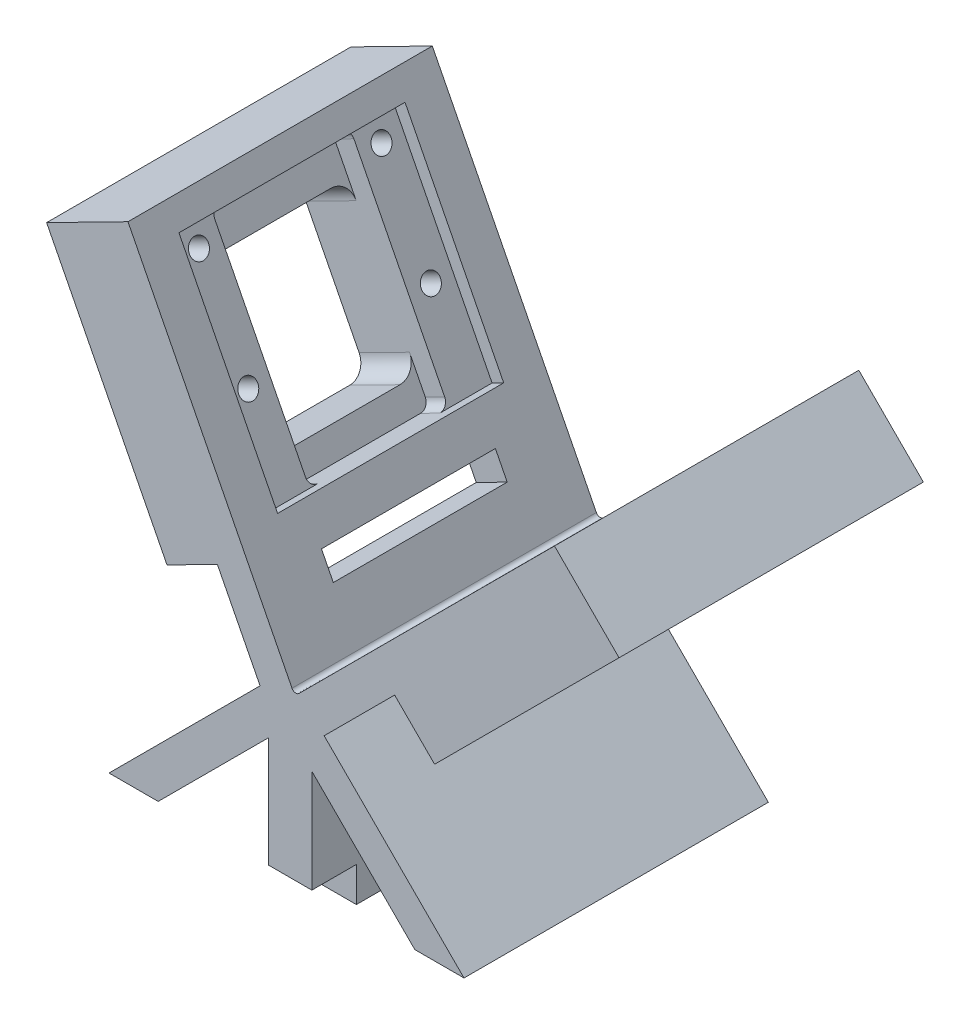
from build123d import *

# Parameters (mm, degrees)
BOSS_EXTRUDE1_DEPTH      = 35
BOSS_EXTRUDE2_DEPTH      = 35
FILLET1_R                = 0.5
SKETCH3_W                = 26
SKETCH3_H                = 25
CUT_EXTRUDE1_DEPTH       = 1.5
SKETCH4_W                = 16
SKETCH4_H                = 25
CUT_EXTRUDE2_DEPTH       = 5
FILLET3_R                = 1
SKETCH5_W                = 26
SKETCH5_H                = 25
CUT_EXTRUDE3_DEPTH       = 1.5
SKETCH6_W                = 16
SKETCH6_H                = 25
CUT_EXTRUDE4_DEPTH       = 5
FILLET4_R                = 1
SKETCH8_W                = 20
SKETCH8_H                = 3
CUT_EXTRUDE5_DEPTH       = 4
SKETCH9_W                = 20
SKETCH9_H                = 3
CUT_EXTRUDE6_DEPTH       = 4
SKETCH10_W               = 20
SKETCH10_H               = 3
CUT_EXTRUDE7_DEPTH       = 4
SKETCH11_R               = 1.1
CUT_EXTRUDE8_DEPTH       = 10
SKETCH12_R               = 1.1
CUT_EXTRUDE9_DEPTH       = 5
BOSS_EXTRUDE3_DEPTH      = 3.5
BOSS_EXTRUDE3_DEPTH_BACK = 1
SKETCH14_W               = 35
SKETCH14_H               = 3.801557548
SKETCH15_W               = 1.5
SKETCH15_H               = 31
CUT_EXTRUDE10_DEPTH      = 5
SKETCH18_W               = 35
SKETCH18_H               = 30
SKETCH18_R               = 1.1
SKETCH18_W_2             = 16
SKETCH18_H_2             = 20
BOSS_EXTRUDE4_DEPTH      = 6.5
SKETCH19_W               = 35
SKETCH19_H               = 30.5
SKETCH19_R               = 1.1
SKETCH19_W_2             = 16
SKETCH19_H_2             = 17.5
BOSS_EXTRUDE5_DEPTH      = 6.5
CUT_EXTRUDE12_DEPTH      = 2.5
CUT_EXTRUDE12_DEPTH_BACK = 10
SKETCH20_W               = 93.401628658
SKETCH20_H               = 53.255346894
SKETCH21_W               = 5
SKETCH21_H               = 4
CUT_EXTRUDE13_DEPTH      = 5.125
FILLET9_R                = 2
FILLET10_R               = 2
BOSS_EXTRUDE8_DEPTH      = 35


with BuildPart() as part:
    # Sketch1 → Boss-Extrude1 (new body)
    with BuildSketch(Plane.XY):
        Polygon((6.55, 4.55), (-6.55, 4.55), (-6.55, -4.55), (-2.05, -4.55), (-2.05, -2.05), (-4.05, -2.05), (-4.05, 2.05), (4.05, 2.05), (4.05, -2.05), (2.05, -2.05), (2.05, -4.55), (6.55, -4.55), align=None)
    extrude(amount=BOSS_EXTRUDE1_DEPTH)

    # Sketch2 → Boss-Extrude2 (add, through all)
    with BuildSketch(Plane.XY.offset(35)):
        Polygon((2.5, 4.55), (2.5, 25.721572875), (33.234018716, 56.455591591), (30.405591591, 59.284018716), (0.532284417, 29.410711541), (-18.64755944, 67.053274588), (-22.211585537, 65.237312589), (-2.5, 26.551147735), (-2.5, 4.55), align=None)
    extrude(amount=-BOSS_EXTRUDE2_DEPTH)

    # Fillet1
    fillet1_edges = [part.edges().sort_by_distance(p)[0] for p in [
        (0.532284417, 29.410711541, 17.5),
    ]]
    fillet(fillet1_edges, radius=FILLET1_R)

    # Sketch3 → Cut-Extrude1 (cut)
    with BuildSketch(Plane(origin=(-14.439213562, 14.439213562, 0), x_dir=(0, 0, 1), z_dir=(-0.7071067811865464, 0.7071067811865488, 0))):
        with Locations((17.5, 47.92013165)):
            Rectangle(SKETCH3_W, SKETCH3_H)
    extrude(amount=-CUT_EXTRUDE1_DEPTH, mode=Mode.SUBTRACT)

    # Sketch4 → Cut-Extrude2 (cut)
    with BuildSketch(Plane(origin=(-13.378553391, 13.378553391, 0), x_dir=(0, 0, 1), z_dir=(-0.7071067811865461, 0.707106781186549, 0))):
        with Locations((17.5, 47.92013165)):
            Rectangle(SKETCH4_W, SKETCH4_H)
    extrude(amount=-CUT_EXTRUDE2_DEPTH, mode=Mode.SUBTRACT)

    # Fillet3
    fillet3_edges = [part.edges().sort_by_distance(p)[0] for p in [
        (30.228814896, 55.218154724, 9.5),
        (30.228814896, 55.218154724, 25.5),
        (12.551145366, 37.540485194, 25.5),
        (12.551145366, 37.540485194, 9.5),
    ]]
    fillet(fillet3_edges, radius=FILLET3_R)

    # Sketch5 → Cut-Extrude3 (cut)
    with BuildSketch(Plane(origin=(12.3194594, 6.277078088, 0), x_dir=(0, 0, -1), z_dir=(0.8910065241883675, 0.45399049973954786, 0))):
        with Locations((-17.5, 52.710719955)):
            Rectangle(SKETCH5_W, SKETCH5_H)
    extrude(amount=-CUT_EXTRUDE3_DEPTH, mode=Mode.SUBTRACT)

    # Sketch6 → Cut-Extrude4 (cut)
    with BuildSketch(Plane(origin=(10.982949614, 5.596092339, 0), x_dir=(0, 0, -1), z_dir=(0.8910065241883673, 0.4539904997395479, 0))):
        with Locations((-17.5, 52.710719955)):
            Rectangle(SKETCH6_W, SKETCH6_H)
    extrude(amount=-CUT_EXTRUDE4_DEPTH, mode=Mode.SUBTRACT)

    # Fillet4
    fillet4_edges = [part.edges().sort_by_distance(p)[0] for p in [
        (-19.735855882, 63.131781141, 25.5),
        (-19.735855882, 63.131781141, 9.5),
        (-8.386093389, 40.856618036, 9.5),
        (-8.386093389, 40.856618036, 25.5),
    ]]
    fillet(fillet4_edges, radius=FILLET4_R)

    # Sketch8 → Cut-Extrude5 (cut)
    with BuildSketch(Plane(origin=(-11.610786438, 11.610786438, 0), x_dir=(0, 0, -1), z_dir=(0.7071067811865465, -0.7071067811865487, 0))):
        with Locations((-17.5, 29.42013165)):
            Rectangle(SKETCH8_W, SKETCH8_H)
    extrude(amount=-CUT_EXTRUDE5_DEPTH, mode=Mode.SUBTRACT)

    # Sketch9 → Cut-Extrude6 (cut)
    with BuildSketch(Plane(origin=(8.755433303, 4.461116089, 0), x_dir=(0, 0, 1), z_dir=(-0.8910065241883675, -0.45399049973954797, 0))):
        with Locations((17.5, 34.210719955)):
            Rectangle(SKETCH9_W, SKETCH9_H)
    extrude(amount=-CUT_EXTRUDE6_DEPTH, mode=Mode.SUBTRACT)

    # Sketch10 → Cut-Extrude7 (cut)
    with BuildSketch(Plane.ZY.offset(2.5)):
        with Locations((17.5, 19.55)):
            Rectangle(SKETCH10_W, SKETCH10_H)
    extrude(amount=-CUT_EXTRUDE7_DEPTH, mode=Mode.SUBTRACT)

    # Sketch11 → Cut-Extrude8 (cut)
    with BuildSketch(Plane(origin=(-13.378553391, 13.378553391, 0), x_dir=(0, 0, 1), z_dir=(-0.7071067811865461, 0.707106781186549, 0))):
        with Locations(Location((28, 57.92013165, 0), (0, 0, 270))):
            Circle(SKETCH11_R)
        with Locations(Location((7, 57.92013165, 0), (0, 0, 270))):
            Circle(SKETCH11_R)
        with Locations(Location((28, 45.42013165, 0), (0, 0, 270))):
            Circle(SKETCH11_R)
        with Locations(Location((7, 45.42013165, 0), (0, 0, 270))):
            Circle(SKETCH11_R)
    extrude(amount=-CUT_EXTRUDE8_DEPTH, mode=Mode.SUBTRACT)

    # Sketch12 → Cut-Extrude9 (cut)
    with BuildSketch(Plane(origin=(10.982949614, 5.596092339, 0), x_dir=(0, 0, -1), z_dir=(0.8910065241883673, 0.4539904997395479, 0))):
        with Locations(Location((-7, 62.710719955, 0), (0, 0, 90))):
            Circle(SKETCH12_R)
        with Locations(Location((-28, 62.710719955, 0), (0, 0, 90))):
            Circle(SKETCH12_R)
        with Locations(Location((-7, 50.210719955, 0), (0, 0, 90))):
            Circle(SKETCH12_R)
        with Locations(Location((-28, 50.210719955, 0), (0, 0, 90))):
            Circle(SKETCH12_R)
    extrude(amount=-CUT_EXTRUDE9_DEPTH, mode=Mode.SUBTRACT)

    # Sketch14 → Boss-Extrude3 (add, two sides: drawn at the far end of the back side and taken through both)
    with BuildSketch(Plane(origin=(6.55, 0, 0), x_dir=(0, 0, -1), z_dir=(1, 0, 0)).offset(-BOSS_EXTRUDE3_DEPTH_BACK)):
        with Locations((-17.5, -0.05)):
            Rectangle(SKETCH14_W, SKETCH14_H)
    extrude(amount=BOSS_EXTRUDE3_DEPTH + BOSS_EXTRUDE3_DEPTH_BACK)

    # Sketch15 → Cut-Extrude10 (cut)
    with BuildSketch(Plane(origin=(0, 1.850778774, 0), x_dir=(1, 0, 0), z_dir=(0, 1, 0))):
        with Locations((7.3, -17.5)):
            Rectangle(SKETCH15_W, SKETCH15_H)
    extrude(amount=-CUT_EXTRUDE10_DEPTH, mode=Mode.SUBTRACT)

    # Sketch18 → Boss-Extrude4 (add)
    with BuildSketch(Plane(origin=(-11.610786438, 11.610786438, 0), x_dir=(0, 0, -1), z_dir=(0.7071067811865465, -0.7071067811865487, 0))):
        with Locations((-17.5, 48.42013165)):
            Rectangle(SKETCH18_W, SKETCH18_H)
        with Locations(Location((-7, 57.92013165, 0), (0, 0, 270))):
            Circle(SKETCH18_R, mode=Mode.SUBTRACT)
        with Locations(Location((-7, 45.42013165, 0), (0, 0, 270))):
            Circle(SKETCH18_R, mode=Mode.SUBTRACT)
        with Locations(Location((-28, 45.42013165, 0), (0, 0, 270))):
            Circle(SKETCH18_R, mode=Mode.SUBTRACT)
        with Locations(Location((-28, 57.92013165, 0), (0, 0, 270))):
            Circle(SKETCH18_R, mode=Mode.SUBTRACT)
        with Locations((-17.5, 48.92013165)):
            Rectangle(SKETCH18_W_2, SKETCH18_H_2, mode=Mode.SUBTRACT)
    extrude(amount=BOSS_EXTRUDE4_DEPTH)

    # Sketch19 → Boss-Extrude5 (add)
    with BuildSketch(Plane(origin=(8.755433303, 4.461116089, 0), x_dir=(0, 0, 1), z_dir=(-0.8910065241883673, -0.45399049973954797, 0))):
        with Locations((17.5, 52.960719955)):
            Rectangle(SKETCH19_W, SKETCH19_H)
        with Locations(Location((28, 50.210719955, 0), (0, 0, 90))):
            Circle(SKETCH19_R, mode=Mode.SUBTRACT)
        with Locations(Location((7, 50.210719955, 0), (0, 0, 90))):
            Circle(SKETCH19_R, mode=Mode.SUBTRACT)
        with Locations(Location((7, 62.710719955, 0), (0, 0, 90))):
            Circle(SKETCH19_R, mode=Mode.SUBTRACT)
        with Locations(Location((28, 62.710719955, 0), (0, 0, 90))):
            Circle(SKETCH19_R, mode=Mode.SUBTRACT)
        with Locations((17.5, 51.960719955)):
            Rectangle(SKETCH19_W_2, SKETCH19_H_2, mode=Mode.SUBTRACT)
    extrude(amount=BOSS_EXTRUDE5_DEPTH)

    # Sketch20 → Cut-Extrude12 (cut, two sides: drawn at the far end of the back side and taken through both)
    with BuildSketch(Plane(origin=(0, 4.55, 0), x_dir=(1, 0, 0), z_dir=(0, 1, 0)).offset(-CUT_EXTRUDE12_DEPTH_BACK)):
        with Locations((0, -16.396538254)):
            Rectangle(SKETCH20_W, SKETCH20_H)
    extrude(amount=CUT_EXTRUDE12_DEPTH + CUT_EXTRUDE12_DEPTH_BACK, mode=Mode.SUBTRACT)

    # Sketch21 → Cut-Extrude13 (cut)
    with BuildSketch(Plane.XY.offset(35)):
        with Locations((0, 9.05)):
            Rectangle(SKETCH21_W, SKETCH21_H)
    cut_extrude13 = extrude(amount=-CUT_EXTRUDE13_DEPTH, mode=Mode.SUBTRACT)

    # Mirror1: Cut-Extrude13 across plane
    add(cut_extrude13.mirror(Plane(origin=(0, 0, 17.5), x_dir=(1, 0, 0), z_dir=(0, 0, -1))), mode=Mode.SUBTRACT)

    # Fillet9
    fillet9_edges = [part.edges().sort_by_distance(p)[0] for p in [
        (-21.702427992, 57.079294533, 9.5),
        (-13.757594247, 41.48668036, 9.5),
        (-13.757594247, 41.48668036, 25.5),
        (-21.702427992, 57.079294533, 25.5),
    ]]
    fillet(fillet9_edges, radius=FILLET9_R)

    # Fillet10
    fillet10_edges = [part.edges().sort_by_distance(p)[0] for p in [
        (32.350135239, 50.975514037, 25.5),
        (18.207999616, 36.833378413, 25.5),
        (18.207999616, 36.833378413, 9.5),
        (32.350135239, 50.975514037, 9.5),
    ]]
    fillet(fillet10_edges, radius=FILLET10_R)

    # Sketch25 → Boss-Extrude8 (add, through all)
    with BuildSketch(Plane.XY.offset(35)):
        Polygon((1.085786438, 24.307359313), (14.343145751, 11.05), (20, 11.05), (3.093757121, 27.956242879), align=None)
        Polygon((-2.594584578, 29.284990281), (-20.829574859, 11.05), (-15.17272061, 11.05), (-1.085786438, 25.136934172), align=None)
    extrude(amount=-BOSS_EXTRUDE8_DEPTH)


solid = part.part
